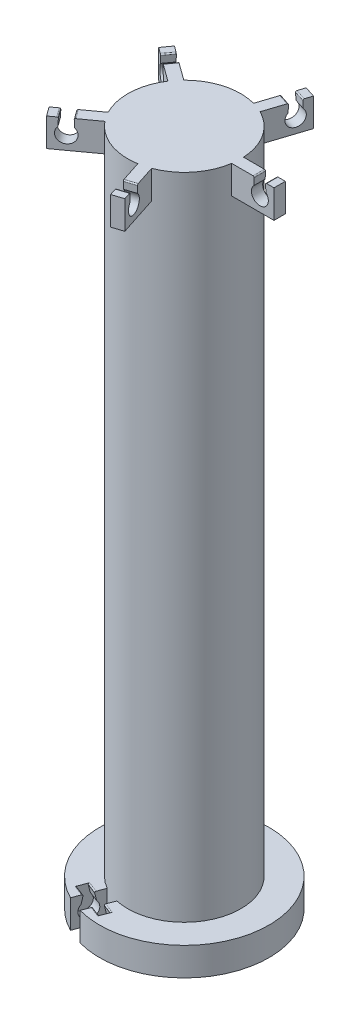
from build123d import *

# Parameters (mm, degrees)
ESQUISSE1_R               = 10
BASE_DEPTH                = 120
BOSS_BALEINE_DEPTH        = 5
VIDE_BALEINE_DEPTH        = 3
REP_SUPPORT_BALEINE_COUNT = 5
CONGE_BALEINE_R           = 0.2
BOSS_EXTRU_3_START        = -5
BOSS_EXTRU_3_DEPTH        = 5
ENL_V_MAT_EXTRU_1_DEPTH   = 2
CONG_1_R                  = 0.2
CONG_1_OF_SYM_VIDE_BLOC_R = 0.2


with BuildPart() as part:
    # Esquisse1 → BASE (new body)
    with BuildSketch(Plane(origin=(0, 0, 0), x_dir=(1, 0, 0), z_dir=(0, 1, 0))):
        with Locations(Location((0, 0, 0), (0, 0, 270))):
            Circle(ESQUISSE1_R)
    extrude(amount=-BASE_DEPTH)

    # Esquisse2 → BOSS - BALEINE (add)
    with BuildSketch(Plane(origin=(0, 0, 0), x_dir=(1, 0, 0), z_dir=(0, 1, 0))):
        with BuildLine():
            ThreePointArc((9.38083152, -1.5), (9.486684928, -0.502801231), (9.486832981, 0.5))
            Line((9.486832981, 0.5), (17.38083152, 0.5))
            Line((17.38083152, 0.5), (17.38083152, -1.5))
            Line((17.38083152, -1.5), (9.38083152, -1.5))
        make_face()
    boss_baleine = extrude(amount=-BOSS_BALEINE_DEPTH)

    # Esquisse3 → VIDE - BALEINE (cut)
    with BuildSketch(Plane.XY.offset(1.5)):
        with BuildLine():
            Line((13.88083152, 0), (13.820171348, -1.439339828))
            ThreePointArc((13.820171348, -1.439339828), (14.88083152, -4), (15.941491691, -1.439339828))
            Line((15.941491691, -1.439339828), (15.88083152, 0))
            Line((15.88083152, 0), (13.88083152, 0))
        make_face()
    vide_baleine = extrude(amount=-VIDE_BALEINE_DEPTH, mode=Mode.SUBTRACT)

    # REP - SUPPORT BALEINE: BOSS - BALEINE, VIDE - BALEINE ×5 about axis
    rep_support_baleine_axis = Axis((0, 0, 0), (0, 1, 0))
    add([boss_baleine.rotate(rep_support_baleine_axis, i * 360 / REP_SUPPORT_BALEINE_COUNT) for i in range(1, REP_SUPPORT_BALEINE_COUNT)])
    add([vide_baleine.rotate(rep_support_baleine_axis, i * 360 / REP_SUPPORT_BALEINE_COUNT) for i in range(1, REP_SUPPORT_BALEINE_COUNT)], mode=Mode.SUBTRACT)

    # CONGE BALEINE
    conge_baleine_edges = [part.edges().sort_by_distance(p)[0] for p in [
        (4.764941094, 0, -13.046946771),
        (5.382975083, 0, -14.949059804),
        (-10.935935969, 0, -8.563456554),
        (-12.553969958, 0, -9.739027059),
        (-11.523721222, 0, 7.75443956),
        (-13.14175521, 0, 8.930010064),
        (3.813884577, 0, 13.355963766),
        (4.431918566, 0, 15.258076798),
        (13.88083152, 0, 0.5),
        (15.88083152, 0, 0.5),
    ]]
    fillet(conge_baleine_edges, radius=CONGE_BALEINE_R)

    # Esquisse4 → Boss.-Extru.3 (add)
    with BuildSketch(Plane.XZ.offset(120).offset(BOSS_EXTRU_3_START)):
        with BuildLine():
            ThreePointArc((10, 0), (-5.017525477, -8.650112027), (-4.964887617, 8.680431496))
            Line((-4.964887617, 8.680431496), (-6.781900496, 13.379305874))
            ThreePointArc((-6.781900496, 13.379305874), (5.409975206, -13.990431311), (-3.983814234, 14.461300915))
            Line((-3.983814234, 14.461300915), (-2.166801355, 9.762426537))
            ThreePointArc((-2.166801355, 9.762426537), (6.258273981, 7.799615809), (10, 0))
        make_face()
    extrude(amount=BOSS_EXTRU_3_DEPTH)

    # Esquisse5 → Enlèv. mat.-Extru.1 (cut)
    with BuildSketch(Plane(origin=(-1.399043131, 0, -0.540997521), x_dir=(0.36066501374715604, 0, -0.9326954207343167), z_dir=(0.9326954207343167, 0, 0.36066501374715604))):
        with BuildLine():
            Line((-13.470498479, -116.443357535), (-13.155835762, -115))
            Line((-13.155835762, -115), (-11.655835762, -115))
            Line((-11.655835762, -115), (-11.341173044, -116.443357535))
            ThreePointArc((-11.341173044, -116.443357535), (-12.405835762, -119), (-13.470498479, -116.443357535))
        make_face()
    enl_v_mat_extru_1 = extrude(amount=-ENL_V_MAT_EXTRU_1_DEPTH, mode=Mode.SUBTRACT)

    # Congé1
    cong_1_edges = [part.edges().sort_by_distance(p)[0] for p in [
        (-7.076588238, -115, 11.368725236),
        (-6.535590717, -115, 9.969682105),
    ]]
    fillet(cong_1_edges, radius=CONG_1_R)

    # SYM VIDE BLOC: Enlèv. mat.-Extru.1 across plane
    add(enl_v_mat_extru_1.mirror(Plane(origin=(0, 0, 0), x_dir=(-0.3606650137471561, 0, 0.9326954207343165), z_dir=(0.9326954207343167, 0, 0.36066501374715604))), mode=Mode.SUBTRACT)

    # Congé1 of SYM VIDE BLOC
    cong_1_of_sym_vide_bloc_edges = [part.edges().sort_by_distance(p)[0] for p in [
        (-2.413111134, -115, 13.172050305),
        (-1.872113613, -115, 11.773007174),
    ]]
    fillet(cong_1_of_sym_vide_bloc_edges, radius=CONG_1_OF_SYM_VIDE_BLOC_R)


solid = part.part
